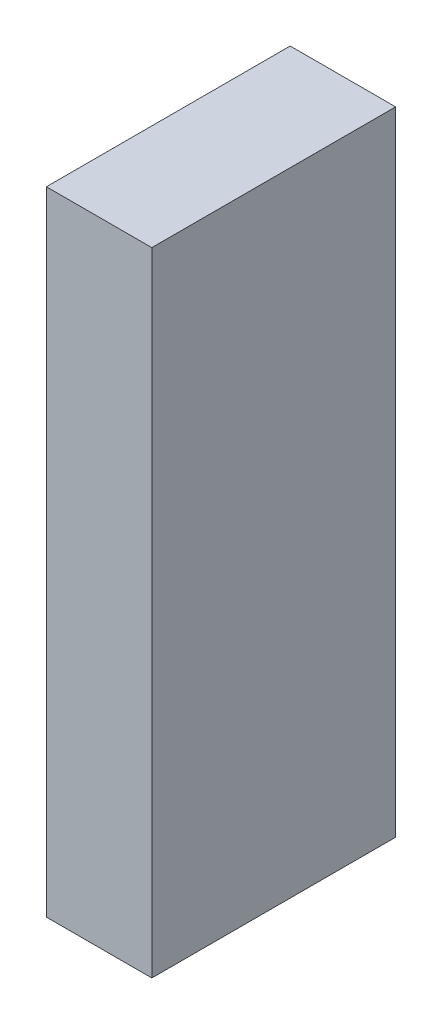
from build123d import *

# Parameters (mm, degrees)
SKETCH1_W           = 38.1
SKETCH1_H           = 88.10625
BOSS_EXTRUDE1_DEPTH = 228.6


with BuildPart() as part:
    # Sketch1 → Boss-Extrude1 (new body)
    with BuildSketch(Plane(origin=(0, 0, 0), x_dir=(1, 0, 0), z_dir=(0, 1, 0))):
        Rectangle(SKETCH1_W, SKETCH1_H)
    extrude(amount=BOSS_EXTRUDE1_DEPTH)


solid = part.part
